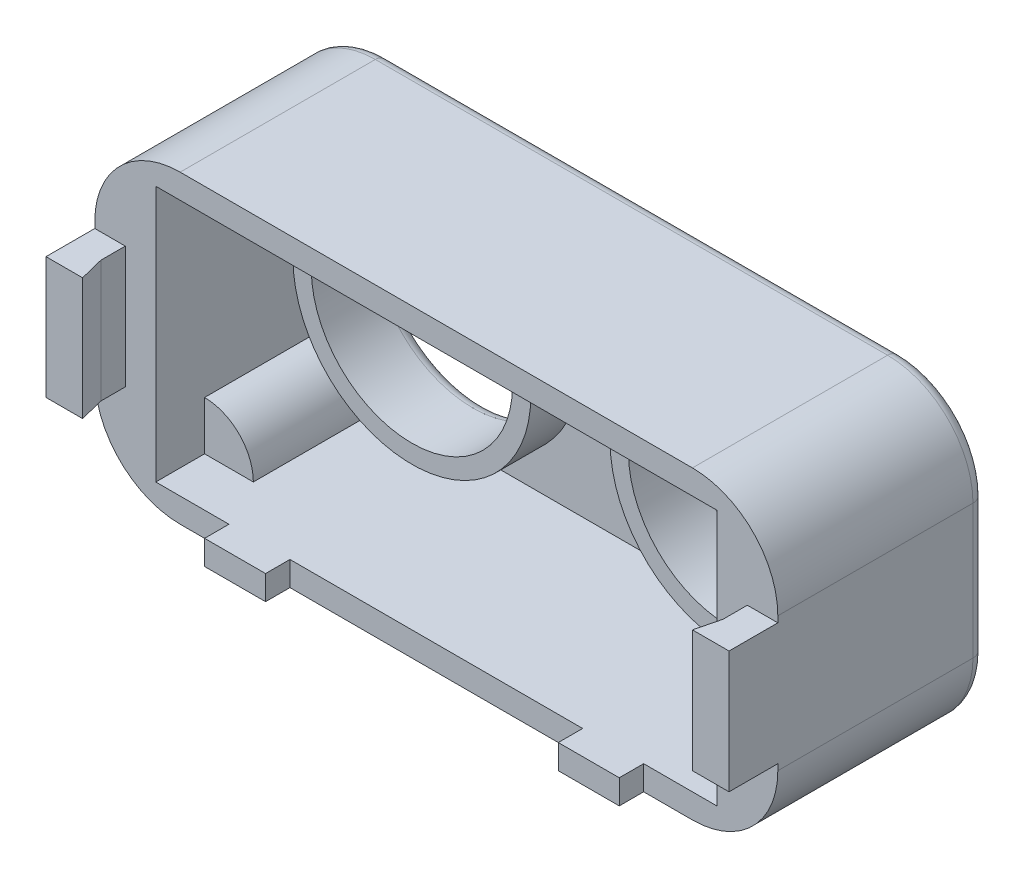
from build123d import *

# Parameters (mm, degrees)
SKETCH2_W                      = 56
SKETCH2_H                      = 25
SKETCH2_W_2                    = 46
SKETCH2_H_2                    = 21
BOX_DEPTH                      = 15
SKETCH3_W                      = 56
SKETCH3_H                      = 25
FRONT_DEPTH                    = 2
SKETCH8_R                      = 9.75
BOSS_EXTRUDE7_DEPTH            = 4
SKETCH1_R                      = 8.25
CUT_EXTRUDE1_DEPTH             = 35.135758377
CUT_EXTRUDE1_DIRECTION_2_REACH = 36.136
FILLET1_R                      = 7
BOSS_EXTRUDE3_DEPTH            = 11
FILLET2_R                      = 1
FILLET3_R                      = 1
SKETCH5_W                      = 2.5
SKETCH5_H                      = 10
BOSS_EXTRUDE4_DEPTH            = 4
SKETCH6_W                      = 5
SKETCH6_H                      = 2
BOSS_EXTRUDE5_DEPTH            = 2
BOSS_EXTRUDE6_DEPTH            = 10


with BuildPart() as part:
    # Sketch2 → Box (new body)
    with BuildSketch(Plane.XY):
        Rectangle(SKETCH2_W, SKETCH2_H)
        Rectangle(SKETCH2_W_2, SKETCH2_H_2, mode=Mode.SUBTRACT)
    extrude(amount=BOX_DEPTH)

    # Sketch3 → Front (add)
    with BuildSketch(Plane(origin=(0, 0, 0), x_dir=(-1, 0, 0), z_dir=(0, 0, -1))):
        Rectangle(SKETCH3_W, SKETCH3_H)
    extrude(amount=FRONT_DEPTH)

    # Sketch8 → Boss-Extrude7 (add)
    with BuildSketch(Plane.XY):
        with Locations(Location((-13, 0, 0), (0, 0, 180))):
            Circle(SKETCH8_R)
        with Locations(Location((13, 0, 0), (0, 0, 180))):
            Circle(SKETCH8_R)
    extrude(amount=BOSS_EXTRUDE7_DEPTH)

    # Sketch1 → Cut-Extrude1 (cut)
    with BuildSketch(Plane.XY):
        with Locations(Location((-13, 0, 0), (0, 0, 180))):
            Circle(SKETCH1_R)
        with Locations(Location((13, 0, 0), (0, 0, 180))):
            Circle(SKETCH1_R)
    extrude(amount=-CUT_EXTRUDE1_DEPTH, mode=Mode.SUBTRACT)

    # Sketch1 → Cut-Extrude1 direction 2 (cut, up to next)
    with BuildSketch(Plane.XY, mode=Mode.PRIVATE) as cut_extrude1_direction_2_sk1:
        with Locations(Location((-13, 0, 0), (0, 0, 180))):
            Circle(SKETCH1_R)
    cut_extrude1_direction_2_tool1 = extrude(cut_extrude1_direction_2_sk1.sketch, amount=CUT_EXTRUDE1_DIRECTION_2_REACH, mode=Mode.PRIVATE) & part.part
    # Sketch1 → Cut-Extrude1 direction 2 (cut, up to next)
    with BuildSketch(Plane.XY, mode=Mode.PRIVATE) as cut_extrude1_direction_2_sk2:
        with Locations(Location((13, 0, 0), (0, 0, 180))):
            Circle(SKETCH1_R)
    cut_extrude1_direction_2_tool2 = extrude(cut_extrude1_direction_2_sk2.sketch, amount=CUT_EXTRUDE1_DIRECTION_2_REACH, mode=Mode.PRIVATE) & part.part
    add(cut_extrude1_direction_2_tool1.solids().sort_by_distance((-13, 0, 0))[0], mode=Mode.SUBTRACT)
    add(cut_extrude1_direction_2_tool2.solids().sort_by_distance((13, 0, 0))[0], mode=Mode.SUBTRACT)

    # Fillet1
    fillet1_edges = [part.edges().sort_by_distance(p)[0] for p in [
        (-28, 12.5, 6.5),
        (28, 12.5, 6.5),
        (28, -12.5, 6.5),
        (-28, -12.5, 6.5),
    ]]
    fillet(fillet1_edges, radius=FILLET1_R)

    # Sketch4 → Boss-Extrude3 (add)
    with BuildSketch(Plane.XY):
        with BuildLine():
            Line((-23, 6.5), (-23, 10.5))
            Line((-23, 10.5), (-19, 10.5))
            ThreePointArc((-19, 10.5), (-20.171572875, 7.671572875), (-23, 6.5))
        make_face()
        with BuildLine():
            Line((19, 10.5), (23, 10.5))
            Line((23, 10.5), (23, 6.5))
            ThreePointArc((23, 6.5), (20.171572875, 7.671572875), (19, 10.5))
        make_face()
        with BuildLine():
            Line((-23, -6.5), (-23, -10.5))
            Line((-23, -10.5), (-19, -10.5))
            ThreePointArc((-19, -10.5), (-20.171572875, -7.671572875), (-23, -6.5))
        make_face()
        with BuildLine():
            Line((23, -6.5), (23, -10.5))
            Line((23, -10.5), (19, -10.5))
            ThreePointArc((19, -10.5), (20.171572875, -7.671572875), (23, -6.5))
        make_face()
    extrude(amount=BOSS_EXTRUDE3_DEPTH)

    # Fillet2
    fillet2_edges = [part.edges().sort_by_distance(p)[0] for p in [
        (0, 12.5, -2),
        (28, 0, -2),
        (0, -12.5, -2),
        (-28, 0, -2),
        (-25.949747468, -10.449747468, -2),
        (25.949747468, -10.449747468, -2),
        (-25.949747468, 10.449747468, -2),
        (25.949747468, 10.449747468, -2),
    ]]
    fillet(fillet2_edges, radius=FILLET2_R)

    # Fillet3
    fillet3_edges = [part.edges().sort_by_distance(p)[0] for p in [
        (-4.75, 0, -2),
        (21.25, 0, -2),
    ]]
    fillet(fillet3_edges, radius=FILLET3_R)

    # Sketch5 → Boss-Extrude4 (add)
    with BuildSketch(Plane.XY.offset(15)):
        with Locations((-26.75, 0)):
            Rectangle(SKETCH5_W, SKETCH5_H)
        with Locations((26.75, 0)):
            Rectangle(SKETCH5_W, SKETCH5_H)
    extrude(amount=BOSS_EXTRUDE4_DEPTH)

    # Sketch6 → Boss-Extrude5 (add)
    with BuildSketch(Plane.XY.offset(15)):
        with Locations((-14.5, -11.5)):
            Rectangle(SKETCH6_W, SKETCH6_H)
        with Locations((14.5, -11.5)):
            Rectangle(SKETCH6_W, SKETCH6_H)
    extrude(amount=BOSS_EXTRUDE5_DEPTH)

    # Sketch7 → Boss-Extrude6 (add)
    with BuildSketch(Plane(origin=(0, 5, 0), x_dir=(1, 0, 0), z_dir=(0, 1, 0))):
        Polygon((-25.5, -17), (-25, -19), (-25.5, -19), align=None)
        Polygon((25.5, -19), (25.5, -17), (25, -19), align=None)
    extrude(amount=-BOSS_EXTRUDE6_DEPTH)


solid = part.part
